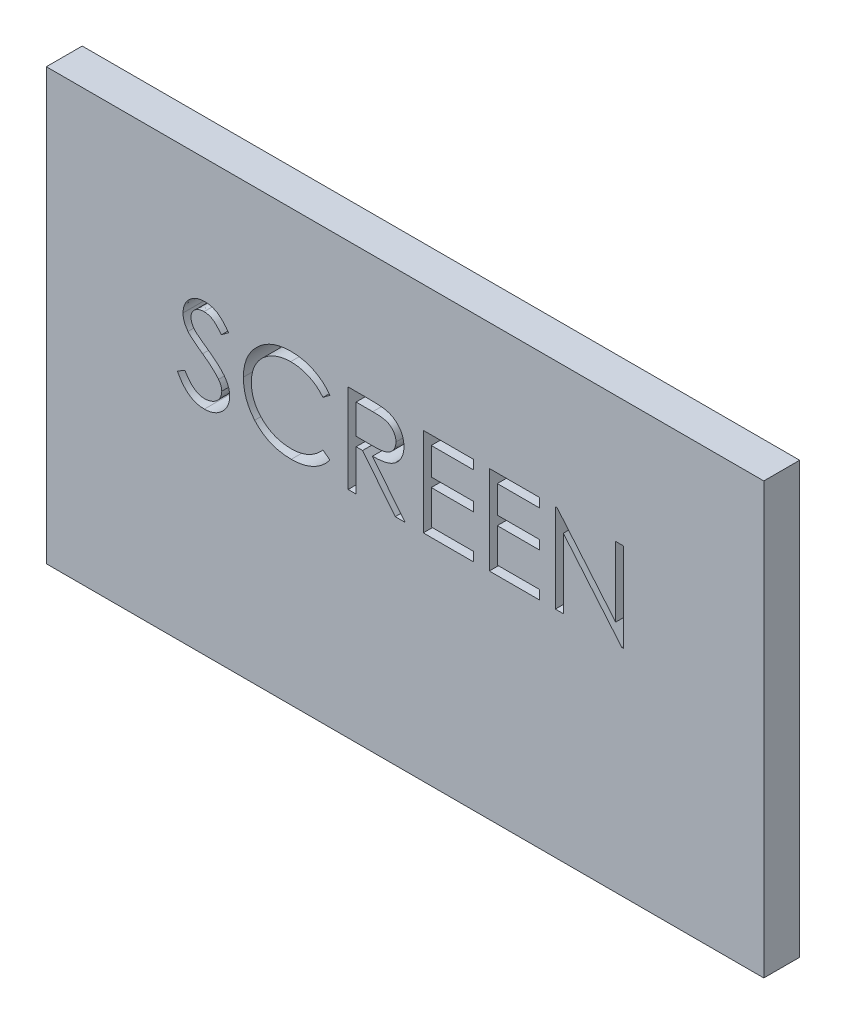
from build123d import *

# Parameters (mm, degrees)
SKETCH1_W           = 152.4
SKETCH1_H           = 91.44
BOSS_EXTRUDE1_DEPTH = 7.62
CUT_EXTRUDE1_DEPTH  = 158.100168077


with BuildPart() as part:
    # Sketch1 → Boss-Extrude1 (new body)
    with BuildSketch(Plane.XY):
        with Locations((-45.591635996, 53.220364924)):
            Rectangle(SKETCH1_W, SKETCH1_H)
    extrude(amount=BOSS_EXTRUDE1_DEPTH)

    # Sketch2 → Cut-Extrude1 (cut, through all)
    # profile 1 of 6: a face of its own
    with BuildSketch(Plane.XY.offset(7.62)):
        with BuildLine():
            Line((-93.960776621, 56.859386988), (-92.366106516, 57.815433284))
            add(Edge.make_bspline(
                [(-92.366106516, 57.815433284), (-92.217791356, 57.567159873), (-91.933625233, 57.091477598), (-91.459593419, 56.448712032), (-90.968413982, 55.902399986), (-90.456449568, 55.455719583), (-89.92682517, 55.104047381), (-89.376083343, 54.855031017), (-88.806080022, 54.699721432), (-88.418162411, 54.680857001), (-88.22449885, 54.671439143)],
                knots=[0, 0, 0, 0, 1.272034388, 2.437168799, 3.508375237, 4.49857839, 5.41946034, 6.295179144, 7.148887113, 8, 8, 8, 8], degree=3))
            add(Edge.make_bspline(
                [(-88.22449885, 54.671439143), (-88.059105748, 54.676045575), (-87.731213534, 54.685177837), (-87.248499533, 54.772926545), (-86.779693345, 54.907734523), (-86.33445722, 55.100798749), (-85.918934659, 55.334380369), (-85.554554566, 55.616510784), (-85.239547302, 55.9323809), (-84.981870315, 56.284774071), (-84.784175773, 56.663762705), (-84.632228862, 57.052769736), (-84.547906542, 57.457906087), (-84.535204338, 57.730681513), (-84.528794199, 57.868337031)],
                knots=[0, 0, 0, 0, 1.095163259, 2.171163733, 3.241058638, 4.321873601, 5.38011039, 6.391990106, 7.366004449, 8.327778327, 9.272591725, 10.192022065, 11.087607919, 12, 12, 12, 12], degree=3))
            add(Edge.make_bspline(
                [(-84.528794199, 57.868337031), (-84.536740298, 58.025397592), (-84.552893555, 58.344678762), (-84.689422741, 58.815737043), (-84.904198395, 59.281906414), (-85.102338172, 59.570262412), (-85.2052064, 59.719968196)],
                knots=[0, 0, 0, 0, 0.938893495, 1.908633276, 2.914225137, 4, 4, 4, 4], degree=3))
            add(Edge.make_bspline(
                [(-85.2052064, 59.719968196), (-85.289666376, 59.828014646), (-85.46697953, 60.054844653), (-85.771807795, 60.392483944), (-86.129501523, 60.740758111), (-86.527819826, 61.112966003), (-86.981272292, 61.491796439), (-87.475656466, 61.895314314), (-88.023594597, 62.308174159), (-88.407877797, 62.585057093), (-88.6061616, 62.727924128)],
                knots=[0, 0, 0, 0, 0.722233717, 1.516239348, 2.393582979, 3.351407094, 4.387010283, 5.505090956, 6.712668013, 8, 8, 8, 8], degree=3))
            add(Edge.make_bspline(
                [(-88.6061616, 62.727924128), (-88.804632049, 62.869288458), (-89.184092433, 63.139566292), (-89.714755071, 63.540691172), (-90.189288687, 63.907427504), (-90.605584142, 64.243227702), (-90.963458331, 64.54813731), (-91.265731329, 64.819228326), (-91.504703038, 65.063832296), (-91.637589326, 65.222512421), (-91.697251993, 65.293755885)],
                knots=[0, 0, 0, 0, 1.452282411, 2.77665338, 3.964542531, 5.026858415, 5.96415736, 6.766646006, 7.446254459, 8, 8, 8, 8], degree=3))
            add(Edge.make_bspline(
                [(-91.697251993, 65.293755885), (-91.780644436, 65.404789381), (-91.944646866, 65.623151651), (-92.161129756, 65.964453906), (-92.345129747, 66.313832134), (-92.489370802, 66.672225178), (-92.610834356, 67.034601559), (-92.692531119, 67.40568941), (-92.743686942, 67.783823613), (-92.748925662, 68.038290418), (-92.751548105, 68.16567361)],
                knots=[0, 0, 0, 0, 1.068054152, 2.10047183, 3.106115577, 4.101338837, 5.06977816, 6.043150881, 7.020423561, 8, 8, 8, 8], degree=3))
            add(Edge.make_bspline(
                [(-92.751548105, 68.16567361), (-92.744513415, 68.365253143), (-92.730594396, 68.760146336), (-92.612880467, 69.337010857), (-92.427081766, 69.887765423), (-92.166786604, 70.406957432), (-91.831237885, 70.881068052), (-91.442931391, 71.315550905), (-90.98043286, 71.68080352), (-90.472978067, 71.999939002), (-89.917534701, 72.249729831), (-89.335495671, 72.438159175), (-88.725935903, 72.544925215), (-88.313067663, 72.560246877), (-88.103575998, 72.568021174)],
                knots=[0, 0, 0, 0, 1.005424448, 1.989358655, 2.955360095, 3.929531133, 4.905563448, 5.876582895, 6.856512386, 7.866279853, 8.892233794, 9.918561126, 10.94386622, 12, 12, 12, 12], degree=3))
            add(Edge.make_bspline(
                [(-88.103575998, 72.568021174), (-87.881282496, 72.560354042), (-87.439211669, 72.545106563), (-86.78894808, 72.412533144), (-86.162876174, 72.19316856), (-85.659244613, 71.944225355), (-85.265080659, 71.695590668), (-84.964482125, 71.469116243), (-84.659869781, 71.208388715), (-84.348786536, 70.912713603), (-84.036503518, 70.579377907), (-83.718384567, 70.210664527), (-83.393685776, 69.808826741), (-83.184803152, 69.521962424), (-83.07771998, 69.374902125)],
                knots=[0, 0, 0, 0, 1.286793592, 2.559021753, 3.825965368, 5.121522368, 5.803751409, 6.523245864, 7.299691795, 8.125521123, 9.008227632, 9.944561021, 10.946284179, 12, 12, 12, 12], degree=3))
            Line((-83.07771998, 69.374902125), (-84.60814982, 68.214798518))
            add(Edge.make_bspline(
                [(-84.60814982, 68.214798518), (-84.700561325, 68.333850026), (-84.878524277, 68.563115396), (-85.148707385, 68.884187169), (-85.403363623, 69.177475899), (-85.65425651, 69.43222096), (-85.88813535, 69.662372829), (-86.115133751, 69.859419106), (-86.331985005, 70.025290463), (-86.605334153, 70.202307538), (-86.94875381, 70.377777463), (-87.379846804, 70.526258846), (-87.830352105, 70.615485733), (-88.137185981, 70.62728319), (-88.292517954, 70.633255549)],
                knots=[0, 0, 0, 0, 1.181633172, 2.275549214, 3.290209073, 4.226197932, 5.078386478, 5.862611352, 6.581680152, 7.217281963, 8.414376989, 9.595101626, 10.782541182, 12, 12, 12, 12], degree=3))
            add(Edge.make_bspline(
                [(-88.292517954, 70.633255549), (-88.487390916, 70.626724845), (-88.863185066, 70.614130997), (-89.396713161, 70.476585824), (-89.876903067, 70.260017481), (-90.289498752, 69.956496405), (-90.633022207, 69.596889987), (-90.881516994, 69.183074667), (-91.031082173, 68.726122592), (-91.049333219, 68.407366556), (-91.058628183, 68.245029231)],
                knots=[0, 0, 0, 0, 1.14458467, 2.207223713, 3.21896685, 4.227309161, 5.202851033, 6.127160689, 7.046193047, 8, 8, 8, 8], degree=3))
            add(Edge.make_bspline(
                [(-91.058628183, 68.245029231), (-91.056509347, 68.143964307), (-91.05226821, 67.9416692), (-90.993117296, 67.642802436), (-90.917126083, 67.344690675), (-90.796705906, 67.048674197), (-90.630458842, 66.749576015), (-90.412147924, 66.442245714), (-90.13720126, 66.12397447), (-89.92658772, 65.916970084), (-89.815390116, 65.807678004)],
                knots=[0, 0, 0, 0, 0.858281714, 1.717966888, 2.583508476, 3.4729293, 4.427298488, 5.488583878, 6.674047936, 8, 8, 8, 8], degree=3))
            add(Edge.make_bspline(
                [(-89.815390116, 65.807678004), (-89.774097584, 65.770828457), (-89.675995982, 65.683282368), (-89.496648584, 65.53995784), (-89.259809898, 65.3631606), (-88.971664445, 65.144406968), (-88.626899285, 64.890651812), (-88.225476505, 64.60513971), (-87.771870735, 64.278602004), (-87.449987271, 64.050307388), (-87.279789072, 63.929594966)],
                knots=[0, 0, 0, 0, 0.420754252, 0.999615792, 1.744751191, 2.668019286, 3.750313428, 4.999500688, 6.413464383, 8, 8, 8, 8], degree=3))
            add(Edge.make_bspline(
                [(-87.279789072, 63.929594966), (-87.075056234, 63.780616213), (-86.678619469, 63.492139506), (-86.114546066, 63.058722775), (-85.603096506, 62.634834563), (-85.142475116, 62.22318185), (-84.728131316, 61.826887175), (-84.364661947, 61.441182799), (-84.048363487, 61.068831994), (-83.707846185, 60.591452008), (-83.359898631, 60.005154136), (-83.061085304, 59.286823849), (-82.87267015, 58.565701253), (-82.848031034, 58.081022201), (-82.835874277, 57.841885157)],
                knots=[0, 0, 0, 0, 1.163667725, 2.253281268, 3.268753668, 4.215851969, 5.092017293, 5.902905408, 6.650798638, 7.335211899, 8.59617414, 9.77448103, 10.901945474, 12, 12, 12, 12], degree=3))
            add(Edge.make_bspline(
                [(-82.835874277, 57.841885157), (-82.839416057, 57.67276505), (-82.846430839, 57.337809033), (-82.927065739, 56.845971158), (-83.045206251, 56.368276984), (-83.223267171, 55.910631201), (-83.440597068, 55.464661403), (-83.716368011, 55.04206601), (-84.036018891, 54.633491942), (-84.402700763, 54.249833976), (-84.803942158, 53.897637307), (-85.228024001, 53.584338858), (-85.675640409, 53.323108929), (-86.144363135, 53.109941588), (-86.634299845, 52.943219078), (-87.145285759, 52.822420342), (-87.678163183, 52.748281128), (-88.040353904, 52.740585916), (-88.22449885, 52.736673518)],
                knots=[0, 0, 0, 0, 0.983748083, 1.948392443, 2.894712957, 3.844097841, 4.80183111, 5.778335162, 6.776009319, 7.81870978, 8.863265674, 9.881300176, 10.883814829, 11.87499822, 12.874611388, 13.892143829, 14.928324115, 16, 16, 16, 16], degree=3))
            add(Edge.make_bspline(
                [(-88.22449885, 52.736673518), (-88.36697753, 52.739428636), (-88.650140518, 52.744904173), (-89.068971642, 52.793310618), (-89.479341509, 52.861798148), (-89.876100717, 52.970530419), (-90.26436106, 53.102454086), (-90.642433908, 53.264890785), (-91.01050249, 53.459551819), (-91.3706295, 53.682119788), (-91.721899025, 53.941136818), (-92.061016348, 54.242817409), (-92.399108106, 54.578841242), (-92.726195223, 54.958333353), (-93.048893763, 55.375162747), (-93.360841272, 55.833229309), (-93.668494848, 56.330037983), (-93.861529627, 56.679641611), (-93.960776621, 56.859386988)],
                knots=[0, 0, 0, 0, 0.915332311, 1.819136955, 2.706846663, 3.586547465, 4.459518054, 5.340707479, 6.227863349, 7.133153174, 8.059268498, 9.028702269, 10.047606654, 11.120612155, 12.245963614, 13.433783089, 14.680604001, 16, 16, 16, 16], degree=3))
        make_face()
    # profile 2 of 6: a face of its own
    with BuildSketch(Plane.XY.offset(7.62)):
        with BuildLine():
            Line((-61.553452402, 68.622913142), (-63.034757334, 67.489261409))
            add(Edge.make_bspline(
                [(-63.034757334, 67.489261409), (-63.140427273, 67.615197075), (-63.350342493, 67.865370523), (-63.688057062, 68.21666899), (-64.040013604, 68.545792689), (-64.40607758, 68.85430949), (-64.79283801, 69.13143065), (-65.19092587, 69.391597619), (-65.607000502, 69.624797929), (-66.182360779, 69.907557908), (-66.935021379, 70.202623492), (-67.882503569, 70.450028332), (-68.871574114, 70.607521827), (-69.546352148, 70.624579386), (-69.889571482, 70.633255549)],
                knots=[0, 0, 0, 0, 0.757959112, 1.505699292, 2.245454638, 2.979532153, 3.711538275, 4.438200793, 5.171680507, 5.909471876, 7.393775596, 8.890124382, 10.418191784, 12, 12, 12, 12], degree=3))
            add(Edge.make_bspline(
                [(-69.889571482, 70.633255549), (-70.078660089, 70.631078311), (-70.455082383, 70.626744041), (-71.013717, 70.569563994), (-71.561920263, 70.489196982), (-72.099335576, 70.369948033), (-72.625278861, 70.21918389), (-73.143188488, 70.039030794), (-73.645566053, 69.816140439), (-74.13936126, 69.569786436), (-74.612465246, 69.291529778), (-75.060107389, 68.988017467), (-75.480655059, 68.662645892), (-75.874440929, 68.314195549), (-76.241867568, 67.944235684), (-76.580272604, 67.548823581), (-76.888485052, 67.129223391), (-77.172614225, 66.690968173), (-77.427076895, 66.235334479), (-77.640131253, 65.760635899), (-77.828798509, 65.275001432), (-77.978089234, 64.772944226), (-78.096255896, 64.257996976), (-78.177789527, 63.728777669), (-78.234319284, 63.1863919), (-78.238632001, 62.818763878), (-78.240805918, 62.633453151)],
                knots=[0, 0, 0, 0, 1.054917814, 2.100044995, 3.131103042, 4.146048494, 5.169673617, 6.183595914, 7.203665975, 8.234915748, 9.262203917, 10.264457458, 11.251630812, 12.227803204, 13.197192746, 14.159520551, 15.12972552, 16.100847026, 17.073214652, 18.039054194, 19.002613845, 19.979014051, 20.95965708, 21.949030935, 22.966165397, 24, 24, 24, 24], degree=3))
            add(Edge.make_bspline(
                [(-78.240805918, 62.633453151), (-78.234005086, 62.354636636), (-78.220652556, 61.807217393), (-78.101818557, 61.005387803), (-77.921236024, 60.237243523), (-77.650588916, 59.507586213), (-77.316863547, 58.807418584), (-76.895169791, 58.148587318), (-76.406773455, 57.521136466), (-75.844765174, 56.939894873), (-75.228151663, 56.40893503), (-74.566576723, 55.941375053), (-73.861688092, 55.551619224), (-73.121268686, 55.22728867), (-72.339620825, 54.977978589), (-71.518150118, 54.802467595), (-70.658643229, 54.687978524), (-70.071330392, 54.677017547), (-69.772427469, 54.671439143)],
                knots=[0, 0, 0, 0, 1.029171465, 2.020641659, 2.987623507, 3.938342917, 4.889210282, 5.84687017, 6.821220943, 7.821438502, 8.827599549, 9.822697543, 10.807740252, 11.797342354, 12.80366471, 13.83203677, 14.896651826, 16, 16, 16, 16], degree=3))
            add(Edge.make_bspline(
                [(-69.772427469, 54.671439143), (-69.443102047, 54.680541166), (-68.794910836, 54.698456126), (-67.844339336, 54.85022615), (-66.934364494, 55.096308824), (-66.064937362, 55.440699727), (-65.238508969, 55.888397061), (-64.453786032, 56.431128838), (-63.710106176, 57.074057671), (-63.262915504, 57.564968794), (-63.034757334, 57.815433284)],
                knots=[0, 0, 0, 0, 1.028121516, 2.023589091, 2.998037872, 3.967518031, 4.937445131, 5.927275754, 6.942489185, 8, 8, 8, 8], degree=3))
            Line((-63.034757334, 57.815433284), (-61.553452402, 56.693118068))
            add(Edge.make_bspline(
                [(-61.553452402, 56.693118068), (-61.672662473, 56.539304252), (-61.910511605, 56.232413381), (-62.295649182, 55.799772607), (-62.701371551, 55.392828186), (-63.130692269, 55.014861049), (-63.578672583, 54.658308045), (-64.053356298, 54.333299009), (-64.548503212, 54.035297496), (-65.062435652, 53.762433346), (-65.594607572, 53.520342669), (-66.144381307, 53.313088234), (-66.709387105, 53.134554876), (-67.289650793, 52.987674997), (-67.886375977, 52.873030146), (-68.497409302, 52.796390304), (-69.124069542, 52.743884267), (-69.546845602, 52.739098663), (-69.761090952, 52.736673518)],
                knots=[0, 0, 0, 0, 0.986787822, 1.968848986, 2.935600012, 3.899624008, 4.868462664, 5.837806735, 6.815139263, 7.798259679, 8.787526145, 9.778297419, 10.776456485, 11.791383307, 12.812564526, 13.85620153, 14.913611965, 16, 16, 16, 16], degree=3))
            add(Edge.make_bspline(
                [(-69.761090952, 52.736673518), (-69.963979184, 52.73808558), (-70.365165539, 52.740877759), (-70.957487306, 52.786109059), (-71.534129504, 52.847819755), (-72.093444045, 52.940738962), (-72.638483141, 53.050388938), (-73.164305837, 53.197372946), (-73.676086337, 53.362023918), (-74.171768493, 53.555541178), (-74.651773935, 53.773911419), (-75.114554483, 54.020714378), (-75.559897296, 54.293874639), (-75.992180793, 54.587371039), (-76.405019114, 54.910630958), (-76.801989832, 55.259164992), (-77.185318944, 55.631798422), (-77.422480402, 55.900501336), (-77.541720682, 56.035600062)],
                knots=[0, 0, 0, 0, 1.114604814, 2.203992996, 3.262667896, 4.300477797, 5.318619304, 6.316056647, 7.298880507, 8.271930387, 9.238335007, 10.195173496, 11.151986948, 12.108099108, 13.064862484, 14.031167946, 15.010108607, 16, 16, 16, 16], degree=3))
            add(Edge.make_bspline(
                [(-77.541720682, 56.035600062), (-77.73270832, 56.270274193), (-78.112377826, 56.736789262), (-78.598128605, 57.49288921), (-79.01393111, 58.282309537), (-79.350118875, 59.109197577), (-79.612935585, 59.971697865), (-79.795006235, 60.87024518), (-79.913318891, 61.804000349), (-79.926848605, 62.439105789), (-79.93372584, 62.76193368)],
                knots=[0, 0, 0, 0, 0.994628077, 1.977248131, 2.950237994, 3.925870899, 4.908910175, 5.911660606, 6.938484602, 8, 8, 8, 8], degree=3))
            add(Edge.make_bspline(
                [(-79.93372584, 62.76193368), (-79.925343806, 63.101244955), (-79.908852679, 63.768818706), (-79.76874303, 64.748526553), (-79.543352087, 65.687151086), (-79.223220424, 66.582940113), (-78.817346853, 67.440605259), (-78.315960918, 68.253594741), (-77.724887456, 69.027107844), (-77.048762169, 69.749407718), (-76.307314918, 70.409858586), (-75.513310082, 70.99090214), (-74.668301758, 71.474453016), (-73.781599195, 71.878660151), (-72.846562681, 72.189346758), (-71.865187174, 72.4068385), (-70.839316718, 72.542212328), (-70.139396652, 72.55932576), (-69.783763987, 72.568021174)],
                knots=[0, 0, 0, 0, 1.032925535, 2.032216505, 3.007276963, 3.968222605, 4.92396291, 5.891752235, 6.871517503, 7.883894988, 8.900124299, 9.891468569, 10.874487609, 11.85992873, 12.854644235, 13.869047385, 14.917252991, 16, 16, 16, 16], degree=3))
            add(Edge.make_bspline(
                [(-69.783763987, 72.568021174), (-69.567019877, 72.565422592), (-69.137996739, 72.56027896), (-68.503344769, 72.510121607), (-67.885456533, 72.426507857), (-67.28390635, 72.312698486), (-66.695767722, 72.171448775), (-66.125535715, 71.987442664), (-65.569864286, 71.777047306), (-65.032257952, 71.534734471), (-64.515296114, 71.262733661), (-64.019139784, 70.96405984), (-63.547730064, 70.639083281), (-63.097749864, 70.29056789), (-62.67672659, 69.911140477), (-62.272706391, 69.511237379), (-61.899409664, 69.079339767), (-61.668982588, 68.775333855), (-61.553452402, 68.622913142)],
                knots=[0, 0, 0, 0, 1.096760587, 2.17092713, 3.219439832, 4.250915756, 5.268269357, 6.278326846, 7.281116186, 8.274029601, 9.260640565, 10.235837813, 11.203064059, 12.156899882, 13.114053108, 14.069676657, 15.032185724, 16, 16, 16, 16], degree=3))
        make_face()
    # profile 3 of 6: a face of its own
    with BuildSketch(Plane.XY.offset(7.62)):
        with BuildLine():
            Line((-57.683921152, 72.084329768), (-53.90886088, 72.084329768))
            add(Edge.make_bspline(
                [(-53.90886088, 72.084329768), (-53.656940021, 72.083491206), (-53.173224067, 72.081881073), (-52.480252166, 72.072903103), (-51.850588666, 72.047170738), (-51.284562793, 72.025026688), (-50.78218493, 71.98464734), (-50.341914593, 71.94605357), (-49.965779544, 71.895532311), (-49.7380869, 71.848612656), (-49.634993845, 71.827368708)],
                knots=[0, 0, 0, 0, 1.410062039, 2.707475311, 3.878576406, 4.937260626, 5.877586885, 6.699081471, 7.410979367, 8, 8, 8, 8], degree=3))
            add(Edge.make_bspline(
                [(-49.634993845, 71.827368708), (-49.496981714, 71.793269314), (-49.223901626, 71.725797959), (-48.830722346, 71.583188536), (-48.456060699, 71.418157815), (-48.101473004, 71.224323999), (-47.768735349, 71.000248233), (-47.454416902, 70.749798796), (-47.15709137, 70.474346073), (-46.888783106, 70.166945146), (-46.6357955, 69.844444056), (-46.422424512, 69.495709943), (-46.23849288, 69.131034321), (-46.092051829, 68.746708429), (-45.974136023, 68.346459442), (-45.890993155, 67.926661864), (-45.84113199, 67.489228213), (-45.836055667, 67.190865457), (-45.833481699, 67.039579554)],
                knots=[0, 0, 0, 0, 1.027469482, 2.033020251, 3.019912614, 3.986113645, 4.951240523, 5.91722682, 6.890402269, 7.87763091, 8.8651537, 9.85103654, 10.82876324, 11.815024772, 12.821070561, 13.842952187, 14.906261191, 16, 16, 16, 16], degree=3))
            add(Edge.make_bspline(
                [(-45.833481699, 67.039579554), (-45.841399164, 66.788230133), (-45.85684819, 66.297782312), (-46.000888595, 65.586013219), (-46.236831089, 64.922059247), (-46.561955775, 64.306756394), (-46.975990029, 63.752098452), (-47.473593347, 63.264920632), (-48.055043326, 62.857243874), (-48.596327636, 62.57453877), (-49.074470935, 62.393482928), (-49.468098891, 62.266089944), (-49.897480337, 62.167663353), (-50.358501272, 62.079487081), (-50.853080235, 62.012915101), (-51.380031831, 61.964156633), (-51.939731875, 61.933682982), (-52.32422836, 61.929144825), (-52.522026926, 61.926810237)],
                knots=[0, 0, 0, 0, 1.260483769, 2.459530307, 3.627416485, 4.787058657, 5.939039949, 7.08810263, 8.267026773, 9.491475466, 10.141966685, 10.831826277, 11.566392101, 12.351337768, 13.187381173, 14.07005841, 15.007169909, 16, 16, 16, 16], degree=3))
            Line((-52.522026926, 61.926810237), (-45.591635996, 53.220364924))
            Line((-45.591635996, 53.220364924), (-47.685112864, 53.220364924))
            Line((-47.685112864, 53.220364924), (-54.615503794, 61.926810237))
            Line((-54.615503794, 61.926810237), (-55.99100123, 61.926810237))
            Line((-55.99100123, 61.926810237), (-55.99100123, 53.220364924))
            Line((-55.99100123, 53.220364924), (-57.683921152, 53.220364924))
            Line((-57.683921152, 53.220364924), (-57.683921152, 72.084329768))
        make_face()
        with BuildLine():
            Line((-55.99100123, 70.149564143), (-55.99100123, 63.861575862))
            Line((-55.99100123, 63.861575862), (-52.537142283, 63.835123988))
            add(Edge.make_bspline(
                [(-52.537142283, 63.835123988), (-52.375882122, 63.835052646), (-52.063314001, 63.834914366), (-51.611114232, 63.856439639), (-51.190069935, 63.88092678), (-50.801791587, 63.918381697), (-50.446105735, 63.966652275), (-50.123190157, 64.027033047), (-49.832517738, 64.097379804), (-49.493513219, 64.206260592), (-49.114959088, 64.378763565), (-48.703555095, 64.629737831), (-48.353211719, 64.945408061), (-48.057220684, 65.306375181), (-47.8193761, 65.703252783), (-47.651691329, 66.131283525), (-47.545285404, 66.579661634), (-47.532735233, 66.887834724), (-47.526401621, 67.043358393)],
                knots=[0, 0, 0, 0, 1.146690395, 2.22261258, 3.21895312, 4.145990853, 4.996080663, 5.770904154, 6.481378293, 7.121626537, 8.300444488, 9.431385265, 10.535395872, 11.636531494, 12.74115979, 13.810798291, 14.895190096, 16, 16, 16, 16], degree=3))
            add(Edge.make_bspline(
                [(-47.526401621, 67.043358393), (-47.532880698, 67.195060101), (-47.545719865, 67.495677531), (-47.650542975, 67.935778737), (-47.827807013, 68.351146805), (-48.066690767, 68.740092036), (-48.357730241, 69.093148579), (-48.698994525, 69.395226157), (-49.081152556, 69.644497093), (-49.438334715, 69.803786463), (-49.757589601, 69.901447113), (-50.034780258, 69.970172115), (-50.347983936, 70.025386772), (-50.698721411, 70.069625793), (-51.085495377, 70.107649856), (-51.510261477, 70.133260537), (-51.970201484, 70.148426433), (-52.28898595, 70.14917608), (-52.454007822, 70.149564143)],
                knots=[0, 0, 0, 0, 1.101028733, 2.181837193, 3.264309656, 4.369019818, 5.486613113, 6.575447106, 7.666700264, 8.788928104, 9.402425223, 10.0903467, 10.862060571, 11.710948788, 12.657782767, 13.684531032, 14.801375019, 16, 16, 16, 16], degree=3))
            Line((-52.454007822, 70.149564143), (-55.99100123, 70.149564143))
        make_face(mode=Mode.SUBTRACT)
    # profile 4 of 6: a face of its own
    with BuildSketch(Plane.XY.offset(7.62)):
        Polygon((-41.722104746, 72.084329768), (-31.080893808, 72.084329768), (-31.080893808, 70.149564143), (-40.029184824, 70.149564143), (-40.029184824, 64.345267268), (-31.080893808, 64.345267268), (-31.080893808, 62.410501643), (-40.029184824, 62.410501643), (-40.029184824, 55.155130549), (-31.080893808, 55.155130549), (-31.080893808, 53.220364924), (-41.722104746, 53.220364924), align=None)
    # profile 5 of 6: a face of its own
    with BuildSketch(Plane.XY.offset(7.62)):
        Polygon((-27.695053965, 72.084329768), (-17.053843027, 72.084329768), (-17.053843027, 70.149564143), (-26.002134043, 70.149564143), (-26.002134043, 64.345267268), (-17.053843027, 64.345267268), (-17.053843027, 62.410501643), (-26.002134043, 62.410501643), (-26.002134043, 55.155130549), (-17.053843027, 55.155130549), (-17.053843027, 53.220364924), (-27.695053965, 53.220364924), align=None)
    # profile 6 of 6: a face of its own
    with BuildSketch(Plane.XY.offset(7.62)):
        Polygon((-13.668003183, 53.220364924), (-13.668003183, 72.084329768), (-13.312792307, 72.084329768), (-0.850180918, 57.2372709), (-0.850180918, 72.084329768), (0.842739004, 72.084329768), (0.842739004, 53.220364924), (0.457297415, 53.220364924), (-11.975083262, 68.033414241), (-11.975083262, 53.220364924), align=None)
    extrude(amount=-CUT_EXTRUDE1_DEPTH, mode=Mode.SUBTRACT)


with BuildPart() as cut_extrude1_piece_1:
    # of the separate pieces the step leaves, piece 1, a body of its own (cut_extrude1_pieces)
    add(part.part.solids().sort_by_distance((-121.791635996, 98.940364924, 0))[0])


with BuildPart() as cut_extrude1_piece_2:
    # of the separate pieces the step leaves, piece 2, a body of its own (cut_extrude1_pieces)
    add(part.part.solids().sort_by_distance((-52.537142283, 63.835123988, 0))[0])


solid = Compound([cut_extrude1_piece_1.part, cut_extrude1_piece_2.part])
